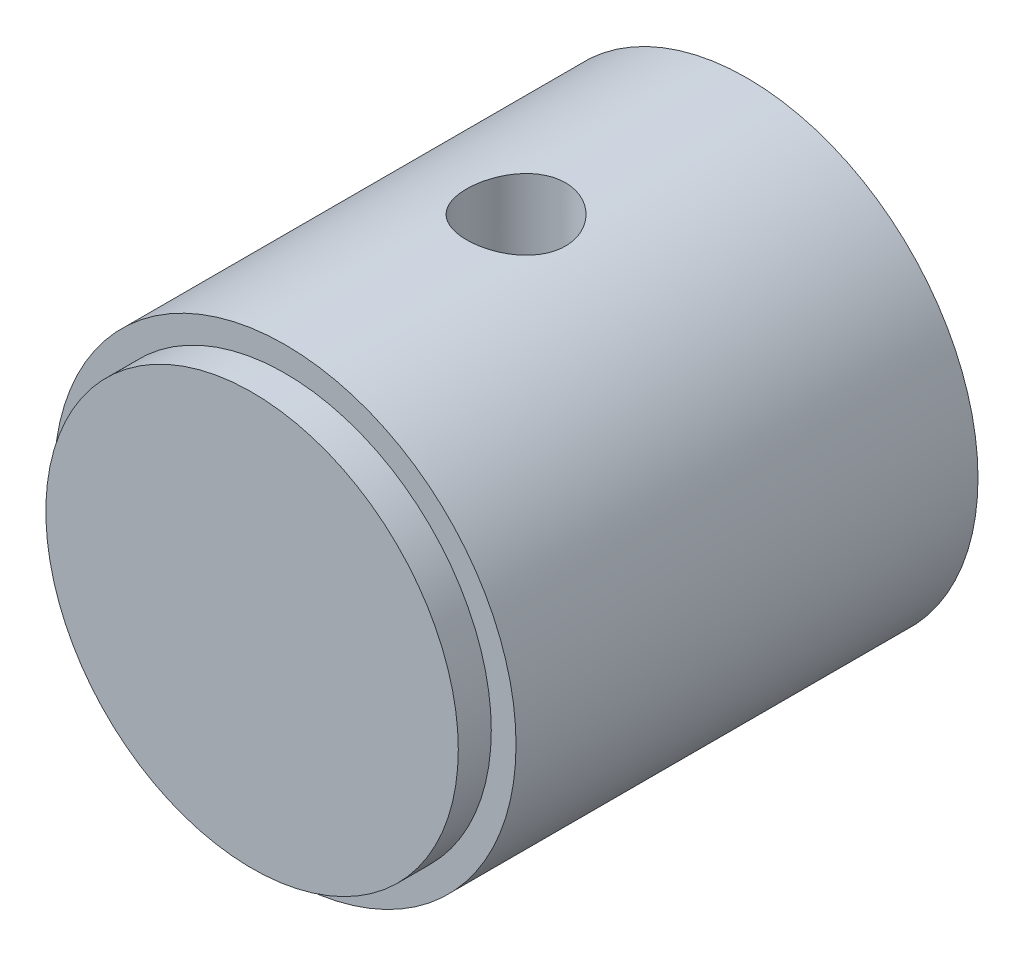
from build123d import *

# Parameters (mm, degrees)
SKETCH1_R                 = 7
BOSS_EXTRUDE1_DEPTH       = 7
SKETCH1_3_R               = 6.25
BOSS_EXTRUDE2_DEPTH       = 8
F_1_0MM_DOWEL_HOLE1_D     = 9.5
F_1_0MM_DOWEL_HOLE1_DEPTH = 11
F_1_0MM_DOWEL_HOLE1_TIP   = 2.85408794
SKETCH10_R                = 1.5
CUT_EXTRUDE1_DEPTH        = 9


with BuildPart() as part:
    # Sketch1 → Boss-Extrude1 (new, symmetric)
    with BuildSketch(Plane.XY):
        Circle(SKETCH1_R)
    extrude(amount=BOSS_EXTRUDE1_DEPTH, both=True)

    # Sketch1<3> → Boss-Extrude2 (add)
    with BuildSketch(Plane.XY):
        Circle(SKETCH1_3_R)
    extrude(amount=BOSS_EXTRUDE2_DEPTH)

    # Ø1.0mm Dowel Hole1
    with Locations(Plane(origin=(0, 0, -7), x_dir=(-1, 0, 0), z_dir=(0, 0, -1))):
        with Locations((0, 0)):
            Hole(F_1_0MM_DOWEL_HOLE1_D / 2, depth=F_1_0MM_DOWEL_HOLE1_DEPTH)
            with Locations((0, 0, -(F_1_0MM_DOWEL_HOLE1_DEPTH + F_1_0MM_DOWEL_HOLE1_TIP / 2))):  # 118° drill point
                Cone(0, F_1_0MM_DOWEL_HOLE1_D / 2, F_1_0MM_DOWEL_HOLE1_TIP, mode=Mode.SUBTRACT)

    # Sketch8 → CSK for M1.6 Countersunk Flat Head Screw1 (revolve, cut)
    with BuildSketch(Plane(origin=(0, 0, -7), x_dir=(0, 1, 0), z_dir=(1, 0, 0))):
        Polygon((0, 0), (0, 13.85408794), (4.75, 11), (4.75, 3.983842258), (6.2, 0), align=None)
    revolve(axis=Axis((0, 0, -13.35), (0, 0, 1)), mode=Mode.SUBTRACT)

    # Sketch10 → Cut-Extrude1 (cut, symmetric)
    with BuildSketch(Plane(origin=(0, 0, 0), x_dir=(1, 0, 0), z_dir=(0, 1, 0))):
        Circle(SKETCH10_R)
    extrude(amount=CUT_EXTRUDE1_DEPTH, both=True, mode=Mode.SUBTRACT)


solid = part.part
